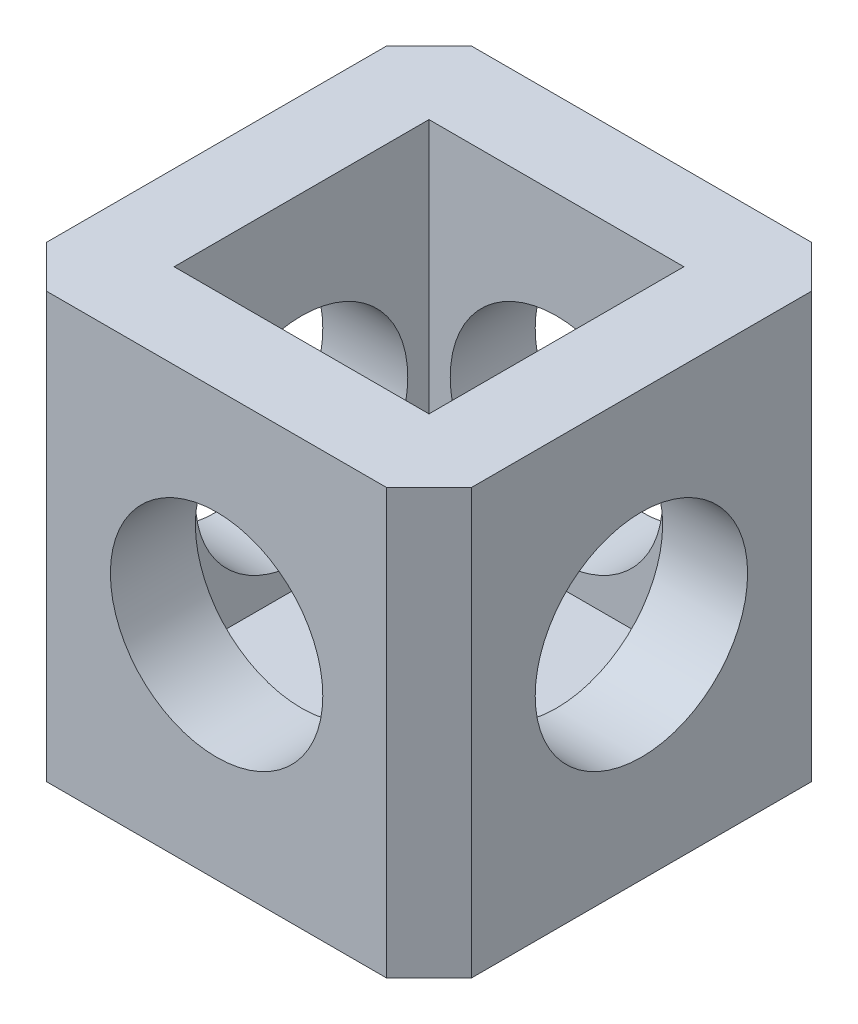
from build123d import *

# Parameters (mm, degrees)
ESQUISSE1_W             = 20
ESQUISSE1_H             = 20
BOSS_EXTRU_1_DEPTH      = 4
ESQUISSE4_W             = 20
ESQUISSE4_H             = 20
ESQUISSE4_W_2           = 12
ESQUISSE4_H_2           = 12
BOSS_EXTRU_2_DEPTH      = 16
ESQUISSE6_R             = 5
ENL_V_MAT_EXTRU_3_DEPTH = 25
ESQUISSE5_R             = 5
ENL_V_MAT_EXTRU_4_DEPTH = 25
CHANFREIN1_SIZE         = 2


with BuildPart() as part:
    # Esquisse1 → Boss.-Extru.1 (new body)
    with BuildSketch(Plane(origin=(0, 0, 0), x_dir=(1, 0, 0), z_dir=(0, 1, 0))):
        Rectangle(ESQUISSE1_W, ESQUISSE1_H)
    extrude(amount=BOSS_EXTRU_1_DEPTH)

    # Esquisse4 → Boss.-Extru.2 (add)
    with BuildSketch(Plane(origin=(0, 4, 0), x_dir=(1, 0, 0), z_dir=(0, 1, 0))):
        Rectangle(ESQUISSE4_W, ESQUISSE4_H)
        Rectangle(ESQUISSE4_W_2, ESQUISSE4_H_2, mode=Mode.SUBTRACT)
    extrude(amount=BOSS_EXTRU_2_DEPTH)

    # Esquisse6 → Enlèv. mat.-Extru.3 (cut)
    with BuildSketch(Plane(origin=(10, 0, 0), x_dir=(0, 0, -1), z_dir=(1, 0, 0))):
        with Locations((0, 10)):
            Circle(ESQUISSE6_R)
    extrude(amount=-ENL_V_MAT_EXTRU_3_DEPTH, mode=Mode.SUBTRACT)

    # Esquisse5 → Enlèv. mat.-Extru.4 (cut)
    with BuildSketch(Plane.XY.offset(10)):
        with Locations((0, 10)):
            Circle(ESQUISSE5_R)
    extrude(amount=-ENL_V_MAT_EXTRU_4_DEPTH, mode=Mode.SUBTRACT)

    # Chanfrein1
    chanfrein1_edges = [part.edges().sort_by_distance(p)[0] for p in [
        (10, 10, -10),
        (10, 10, 10),
        (-10, 10, 10),
        (-10, 10, -10),
    ]]
    chamfer(chanfrein1_edges, length=CHANFREIN1_SIZE)


solid = part.part
